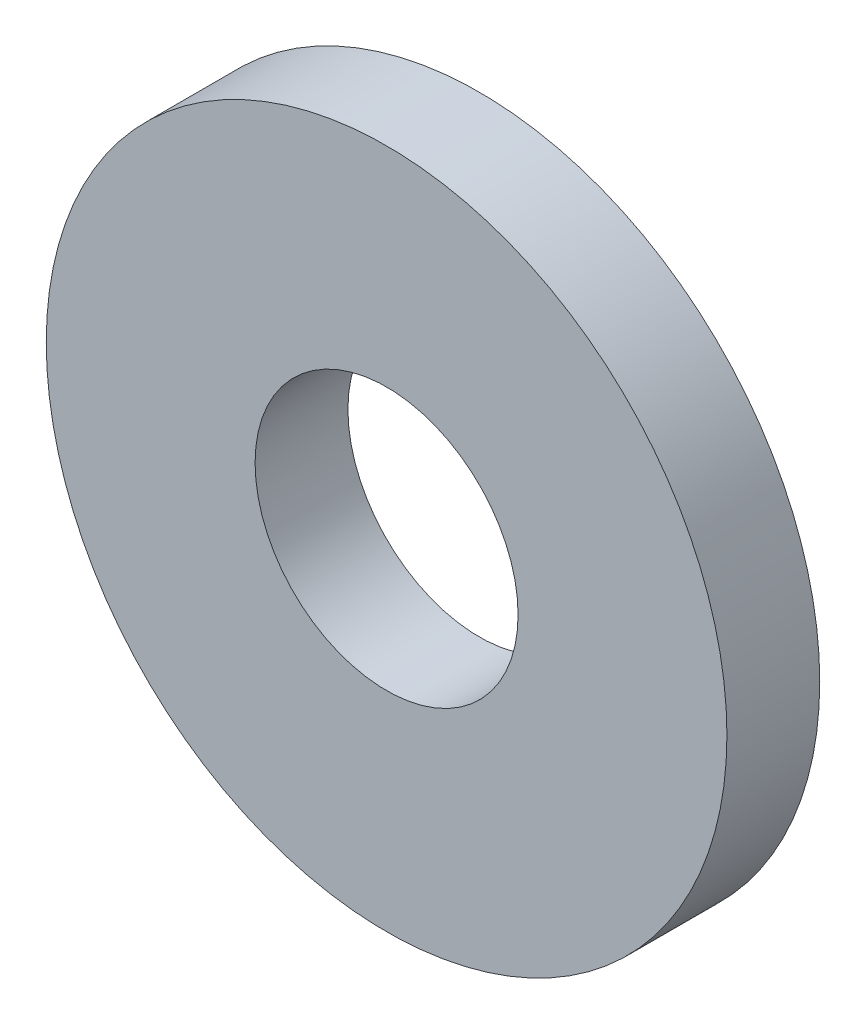
from build123d import *

# Parameters (mm, degrees)
CROQUIS1_R              = 11
CROQUIS1_R_2            = 4.25
SALIENTE_EXTRUIR1_DEPTH = 3


with BuildPart() as part:
    # Croquis1 → Saliente-Extruir1 (new body)
    with BuildSketch(Plane.XY):
        Circle(CROQUIS1_R)
        Circle(CROQUIS1_R_2, mode=Mode.SUBTRACT)
    extrude(amount=-SALIENTE_EXTRUIR1_DEPTH)


solid = part.part
